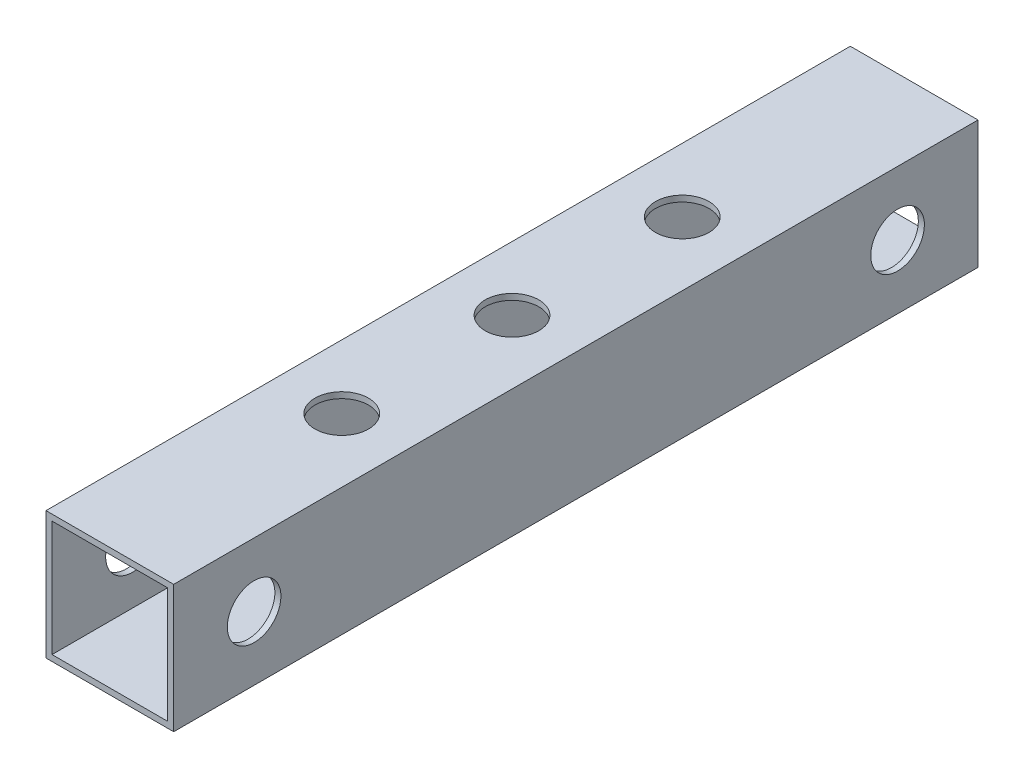
from build123d import *

# Parameters (mm, degrees)
SKETCH1_W           = 19.05
SKETCH1_H           = 19.05
SKETCH1_W_2         = 17.25
SKETCH1_H_2         = 17.25
EXTRUDE_THIN1_DEPTH = 60
SKETCH2_R           = 4
CUT_EXTRUDE1_DEPTH  = 64.668109168
SKETCH3_R           = 4
CUT_EXTRUDE2_DEPTH  = 64.668109168


with BuildPart() as part:
    # Sketch1 → Extrude-Thin1 (new, symmetric)
    with BuildSketch(Plane.XY):
        Rectangle(SKETCH1_W, SKETCH1_H)
        Rectangle(SKETCH1_W_2, SKETCH1_H_2, mode=Mode.SUBTRACT)
    extrude(amount=EXTRUDE_THIN1_DEPTH, both=True)

    # Sketch2 → Cut-Extrude1 (cut, through all)
    with BuildSketch(Plane(origin=(9.525, 0, 0), x_dir=(0, 0, -1), z_dir=(1, 0, 0))):
        with Locations(Location((-48, 0, 0), (0, 0, 90))):
            Circle(SKETCH2_R)
        with Locations(Location((48, 0, 0), (0, 0, 90))):
            Circle(SKETCH2_R)
    extrude(amount=-CUT_EXTRUDE1_DEPTH, mode=Mode.SUBTRACT)

    # Sketch3 → Cut-Extrude2 (cut, through all)
    with BuildSketch(Plane(origin=(0, 9.525, 0), x_dir=(1, 0, 0), z_dir=(0, 1, 0))):
        with Locations(Location((0, -25.4, 0), (0, 0, 270))):
            Circle(SKETCH3_R)
        with Locations(Location((0, 25.4, 0), (0, 0, 270))):
            Circle(SKETCH3_R)
        with Locations(Location((0, 0, 0), (0, 0, 270))):
            Circle(SKETCH3_R)
    extrude(amount=-CUT_EXTRUDE2_DEPTH, mode=Mode.SUBTRACT)


solid = part.part
